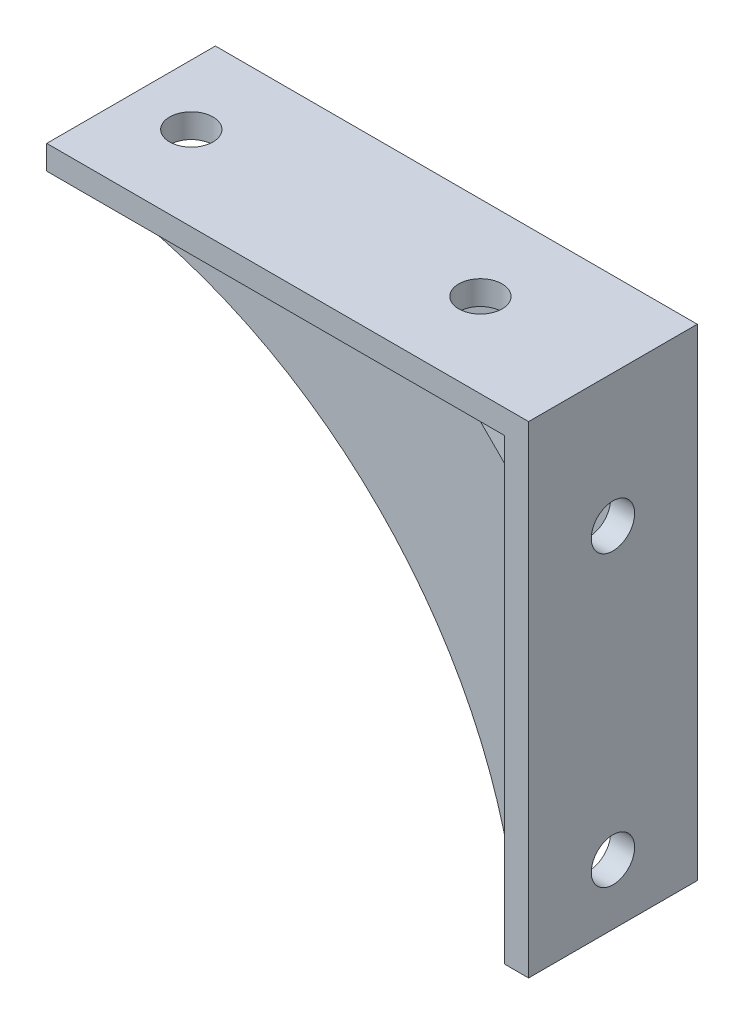
from build123d import *

# Parameters (mm, degrees)
EXTRUDE_THIN1_DEPTH = 35
BOSS_EXTRUDE2_DEPTH = 10
SKETCH4_R           = 9
CUT_EXTRUDE1_DEPTH  = 279.07373123
CIRPATTERN1_COUNT   = 4


with BuildPart() as part:
    # Sketch2 → Extrude-Thin1 (new, symmetric)
    with BuildSketch(Plane.XY):
        Polygon((-200, 0), (0, 0), (0, -200), (-10, -200), (-10, -10), (-200, -10), align=None)
    extrude(amount=EXTRUDE_THIN1_DEPTH, both=True)

    # Sketch3 → Boss-Extrude2 (add)
    with BuildSketch(Plane(origin=(0, 0, -30), x_dir=(-1, 0, 0), z_dir=(0, 0, -1))):
        with BuildLine():
            Line((30, -10), (10, -30))
            Line((10, -30), (10, -185))
            ThreePointArc((10, -185), (67.181073979, -67.181073979), (185, -10))
            Line((185, -10), (30, -10))
        make_face()
    boss_extrude2 = extrude(amount=-BOSS_EXTRUDE2_DEPTH)

    # Mirror1: Boss-Extrude2 across plane
    add(boss_extrude2.mirror(Plane.XY))

    # Sketch4 → Cut-Extrude1 (cut, through all)
    with BuildSketch(Plane.ZY.offset(10)):
        with Locations(Location((0, -55, 0), (0, 0, 270))):
            Circle(SKETCH4_R)
        with Locations(Location((0, -175, 0), (0, 0, 270))):
            Circle(SKETCH4_R)
    cut_extrude1 = extrude(amount=-CUT_EXTRUDE1_DEPTH, mode=Mode.SUBTRACT)

    # CirPattern1: Cut-Extrude1 ×4 about axis
    cirpattern1_axis = Axis((0, 0, 35), (0, 0, -1))
    for i in range(1, CIRPATTERN1_COUNT):
        add(cut_extrude1.rotate(cirpattern1_axis, i * 360 / CIRPATTERN1_COUNT), mode=Mode.SUBTRACT)


solid = part.part
